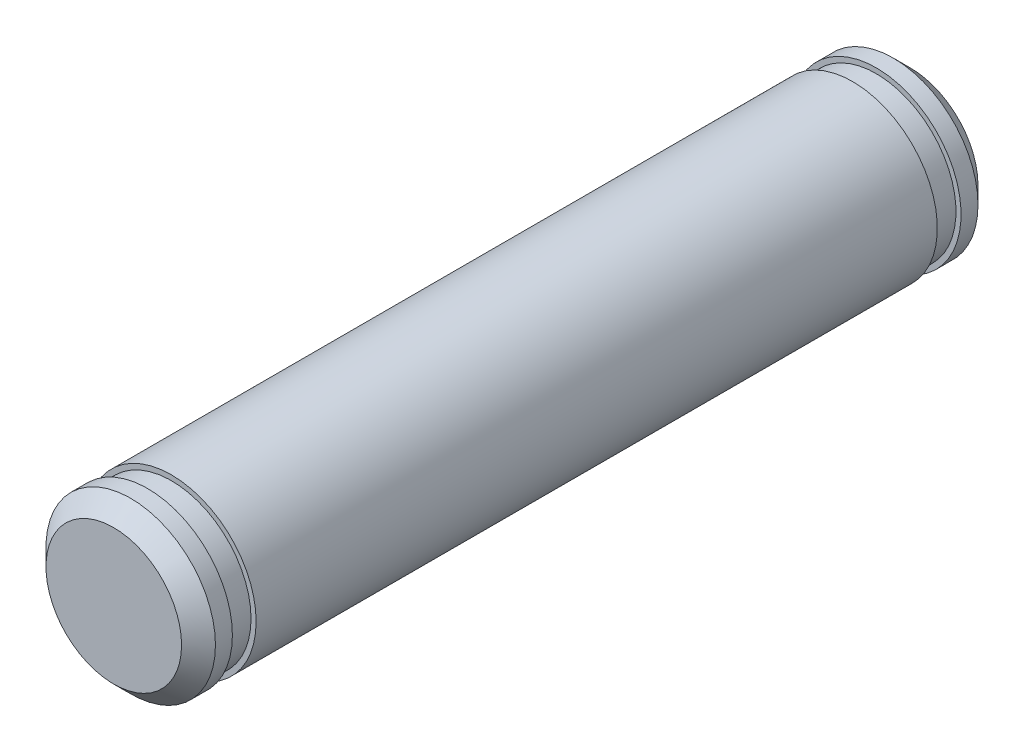
from build123d import *

# Parameters (mm, degrees)
SZKIC1_R                    = 2.5
DODANIE_WYCI_GNI_CIE1_DEPTH = 23.5
SFAZOWANIE1_SIZE            = 0.5
WYTNIJ_WYCI_GNI_CIE1_START  = -1.7
SZKIC2_R                    = 2.5
SZKIC2_R_2                  = 2.35
WYTNIJ_WYCI_GNI_CIE1_DEPTH  = 0.7
WYTNIJ_WYCI_GNI_CIE2_START  = -1
SZKIC3_R                    = 2.5
SZKIC3_R_2                  = 2.35
WYTNIJ_WYCI_GNI_CIE2_DEPTH  = 0.7


with BuildPart() as part:
    # Szkic1 → Dodanie-wyciągnięcie1 (new body)
    with BuildSketch(Plane.XY):
        Circle(SZKIC1_R)
    extrude(amount=DODANIE_WYCI_GNI_CIE1_DEPTH)

    # Sfazowanie1
    sfazowanie1_edges = [part.edges().sort_by_distance(p)[0] for p in [
        (-2.5, 0, 0),
        (-2.5, 0, 23.5),
    ]]
    chamfer(sfazowanie1_edges, length=SFAZOWANIE1_SIZE)

    # Szkic2 → Wytnij-wyciągnięcie1 (cut)
    with BuildSketch(Plane.XY.offset(23.5).offset(WYTNIJ_WYCI_GNI_CIE1_START)):
        Circle(SZKIC2_R)
        Circle(SZKIC2_R_2, mode=Mode.SUBTRACT)
    extrude(amount=WYTNIJ_WYCI_GNI_CIE1_DEPTH, mode=Mode.SUBTRACT)

    # Szkic3 → Wytnij-wyciągnięcie2 (cut)
    with BuildSketch(Plane(origin=(0, 0, 0), x_dir=(-1, 0, 0), z_dir=(0, 0, -1)).offset(WYTNIJ_WYCI_GNI_CIE2_START)):
        Circle(SZKIC3_R)
        with Locations(Location((0, 0, 0), (0, 0, 180))):
            Circle(SZKIC3_R_2, mode=Mode.SUBTRACT)
    extrude(amount=-WYTNIJ_WYCI_GNI_CIE2_DEPTH, mode=Mode.SUBTRACT)


solid = part.part
